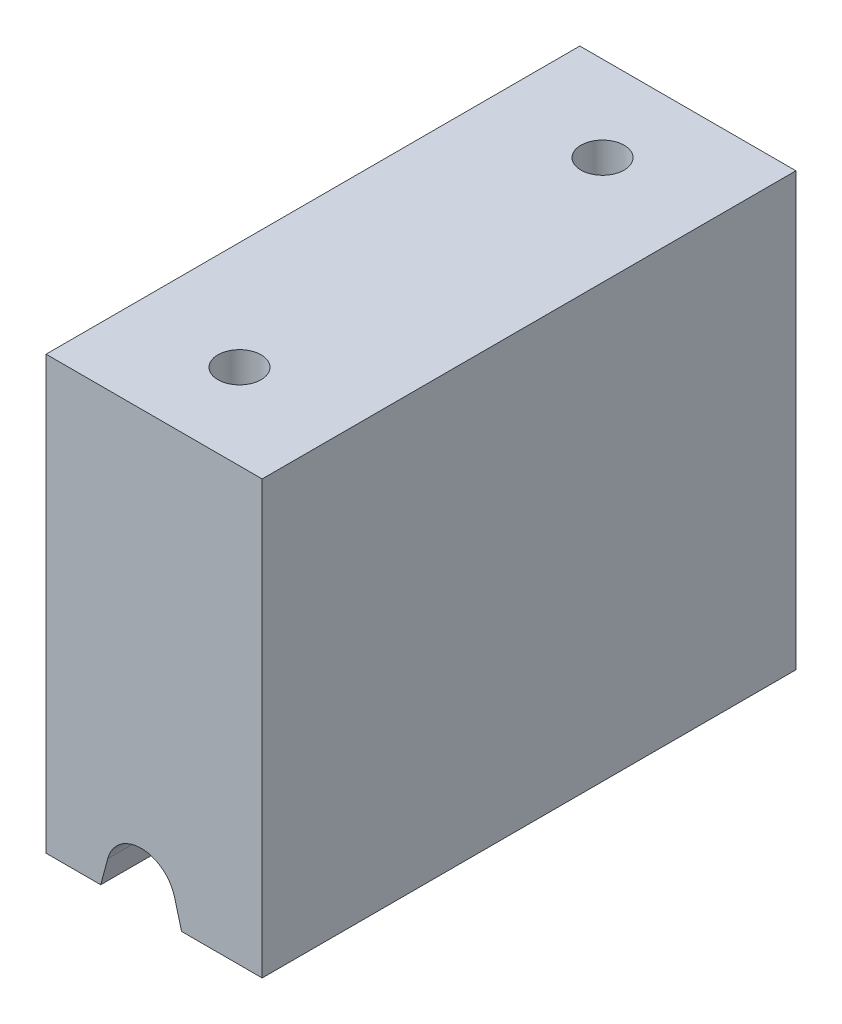
from build123d import *

# Parameters (mm, degrees)
SKETCH1_W             = 25
SKETCH1_H             = 50
BOSS_EXTRUDE1_DEPTH   = 30.875
CUT_EXTRUDE1_REACH    = 82.432
M6_TAPPED_HOLE1_D     = 5
M6_TAPPED_HOLE1_DEPTH = 17
M6_TAPPED_HOLE1_TIP   = 1.502151548


with BuildPart() as part:
    # Sketch1 → Boss-Extrude1 (new, symmetric)
    with BuildSketch(Plane.XY):
        with Locations((0, -25)):
            Rectangle(SKETCH1_W, SKETCH1_H)
    extrude(amount=BOSS_EXTRUDE1_DEPTH, both=True)

    # Sketch2 → Cut-Extrude1 (cut, up to next)
    with BuildSketch(Plane(origin=(0, 0, -30.875), x_dir=(-1, 0, 0), z_dir=(0, 0, -1)), mode=Mode.PRIVATE) as cut_extrude1_sk1:
        with BuildLine():
            Line((-2.363703305, -46.96472382), (-3.177003107, -50))
            Line((-3.177003107, -50), (6.177003107, -50))
            Line((6.177003107, -50), (5.363703305, -46.96472382))
            ThreePointArc((5.363703305, -46.96472382), (1.5, -44), (-2.363703305, -46.96472382))
        make_face()
    cut_extrude1_tool1 = extrude(cut_extrude1_sk1.sketch, amount=-CUT_EXTRUDE1_REACH, mode=Mode.PRIVATE) & part.part
    add(cut_extrude1_tool1.solids().sort_by_distance((-1.5, -47.423831, -30.875))[0], mode=Mode.SUBTRACT)

    # M6 Tapped Hole1
    with Locations(Plane(origin=(0, 0, 0), x_dir=(1, 0, 0), z_dir=(0, 1, 0))):
        with Locations((0, 21), (0, -21)):
            Hole(M6_TAPPED_HOLE1_D / 2, depth=M6_TAPPED_HOLE1_DEPTH)
            with Locations((0, 0, -(M6_TAPPED_HOLE1_DEPTH + M6_TAPPED_HOLE1_TIP / 2))):  # 118° drill point
                Cone(0, M6_TAPPED_HOLE1_D / 2, M6_TAPPED_HOLE1_TIP, mode=Mode.SUBTRACT)


solid = part.part
